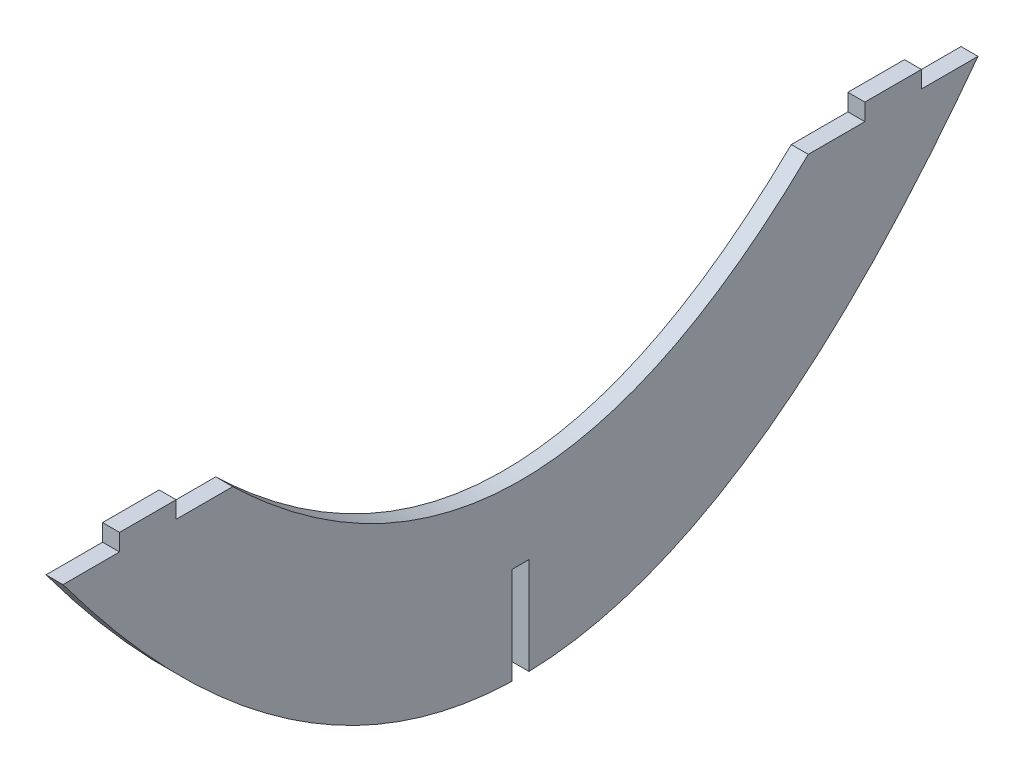
from build123d import *

# Parameters (mm, degrees)
EXTRUDE_1_DEPTH     = 3
EXTRUDE_2_DEPTH     = 3
CUT_EXTRUDE_1_DEPTH = 148.234063023


with BuildPart() as part:
    # 草图1 → 凸台-拉伸1 (new body)
    with BuildSketch(Plane(origin=(0, 0, 0), x_dir=(0, 0, -1), z_dir=(1, 0, 0))):
        with BuildLine():
            Line((-80.87277412, 119.997819814), (-50.87050958, 119.997819814))
            add(Edge.make_bspline(
                [(-50.87050958, 119.997819814), (0, 70.995420186), (50.87050958, 119.997819814)],
                knots=[0.223373809, 0.223373809, 0.223373809, 0.776626191, 0.776626191, 0.776626191], degree=2))
            Line((50.87050958, 119.997819814), (80.87277412, 119.997819814))
            add(Edge.make_bspline(
                [(-80.87277412, 119.997819814), (0, 10.995420186), (80.87277412, 119.997819814)],
                knots=[0.062405008, 0.062405008, 0.062405008, 0.937594992, 0.937594992, 0.937594992], degree=2))
        make_face()
    extrude(amount=EXTRUDE_1_DEPTH)

    # 草图2 → 凸台-拉伸2 (add)
    with BuildSketch(Plane(origin=(0, 119.997819814, 0), x_dir=(1, 0, 0), z_dir=(0, 1, 0))):
        Polygon((0, 60.87164185), (1.999962261, 60.87164185), (1.000037739, 70.87164185), (0, 70.87164185), align=None)
        Polygon((1.000037739, 70.87164185), (1.999962261, 60.87164185), (3, 60.87164185), (3, 70.87164185), align=None)
        Polygon((0, -70.87164185), (1.000037739, -70.87164185), (1.999962261, -60.87164185), (0, -60.87164185), align=None)
        Polygon((1.999962261, -60.87164185), (1.000037739, -70.87164185), (3, -70.87164185), (3, -60.87164185), align=None)
    extrude(amount=EXTRUDE_2_DEPTH)

    # 草图3 → 切除-拉伸1 (cut, through all)
    with BuildSketch(Plane.ZY):
        with BuildLine():
            Line((1.5, 82.642709801), (-1.5, 82.642709801))
            Line((-1.5, 82.642709801), (-1.5, 65.51536925))
            add(Edge.make_bspline(
                [(-1.5, 65.51536925), (0, 65.47787075), (1.5, 65.51536925)],
                knots=[0.491883641, 0.491883641, 0.491883641, 0.508116359, 0.508116359, 0.508116359], degree=2))
            Line((1.5, 65.51536925), (1.5, 82.642709801))
        make_face()
    extrude(amount=-CUT_EXTRUDE_1_DEPTH, mode=Mode.SUBTRACT)


solid = part.part
